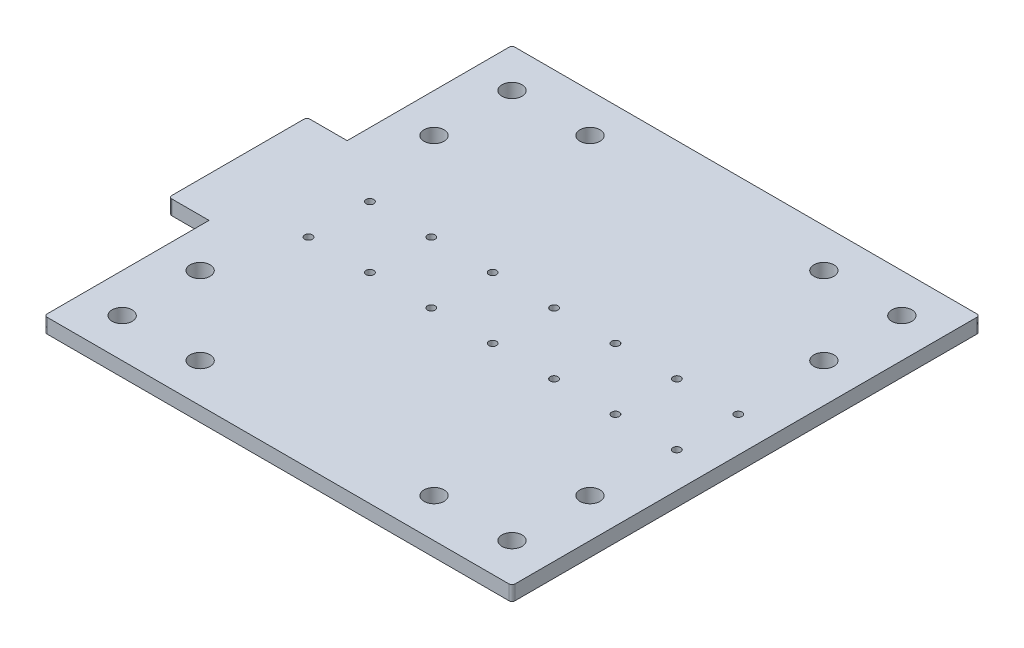
from build123d import *

# Parameters (mm, degrees)
SKETCH1_W             = 152.4
SKETCH1_H             = 152.4
SKETCH1_R             = 3.2639
SKETCH1_W_2           = 13.1
SKETCH1_H_2           = 45
BOSS_EXTRUDE1_DEPTH   = 4.7625
FILLET1_R             = 1
SKETCH11_R            = 1
CUT_EXTRUDE1_DEPTH    = 4.7625
M3X0_5_TAPPED_HOLE1_D = 2.5
LPATTERN1_COUNT       = 7
LPATTERN1_PITCH       = 20
LPATTERN1_COUNT_DIR2  = 2
LPATTERN1_PITCH_DIR2  = 20


with BuildPart() as part:
    # Sketch1 → Boss-Extrude1 (new body)
    # profile 1 of 2: a face of its own
    with BuildSketch(Plane(origin=(0, 0, 0), x_dir=(1, 0, 0), z_dir=(0, 1, 0))):
        with Locations((76.2, -76.2)):
            Rectangle(SKETCH1_W, SKETCH1_H)
        with Locations(Location((12.7, -12.7, 0), (0, 0, 90))):
            Circle(SKETCH1_R, mode=Mode.SUBTRACT)
        with Locations(Location((139.7, -12.7, 0), (0, 0, 90))):
            Circle(SKETCH1_R, mode=Mode.SUBTRACT)
        with Locations(Location((139.7, -139.7, 0), (0, 0, 90))):
            Circle(SKETCH1_R, mode=Mode.SUBTRACT)
        with Locations(Location((12.7, -139.7, 0), (0, 0, 90))):
            Circle(SKETCH1_R, mode=Mode.SUBTRACT)
        with Locations(Location((38.1, -12.7, 0), (0, 0, 90))):
            Circle(SKETCH1_R, mode=Mode.SUBTRACT)
        with Locations(Location((114.3, -12.7, 0), (0, 0, 90))):
            Circle(SKETCH1_R, mode=Mode.SUBTRACT)
        with Locations(Location((139.7, -38.1, 0), (0, 0, 90))):
            Circle(SKETCH1_R, mode=Mode.SUBTRACT)
        with Locations(Location((139.7, -114.3, 0), (0, 0, 90))):
            Circle(SKETCH1_R, mode=Mode.SUBTRACT)
        with Locations(Location((114.3, -139.7, 0), (0, 0, 90))):
            Circle(SKETCH1_R, mode=Mode.SUBTRACT)
        with Locations(Location((38.1, -139.7, 0), (0, 0, 90))):
            Circle(SKETCH1_R, mode=Mode.SUBTRACT)
        with Locations(Location((12.7, -114.3, 0), (0, 0, 90))):
            Circle(SKETCH1_R, mode=Mode.SUBTRACT)
        with Locations(Location((12.7, -38.1, 0), (0, 0, 90))):
            Circle(SKETCH1_R, mode=Mode.SUBTRACT)
    # profile 2 of 2: a face of its own
    with BuildSketch(Plane(origin=(0, 0, 0), x_dir=(1, 0, 0), z_dir=(0, 1, 0))):
        with Locations((-6.55, -76.2)):
            Rectangle(SKETCH1_W_2, SKETCH1_H_2)
    extrude(amount=BOSS_EXTRUDE1_DEPTH)

    # Fillet1
    fillet1_edges = [part.edges().sort_by_distance(p)[0] for p in [
        (152.4, 2.38125, 152.4),
        (0, 2.38125, 152.4),
        (-13.1, 2.38125, 98.7),
        (-13.1, 2.38125, 53.7),
        (0, 2.38125, 0),
        (152.4, 2.38125, 0),
    ]]
    fillet(fillet1_edges, radius=FILLET1_R)

    # Sketch11 → Cut-Extrude1 (cut)
    with BuildSketch(Plane(origin=(0, 4.7625, 0), x_dir=(1, 0, 0), z_dir=(0, 1, 0))):
        with Locations(Location((20.905, -87.2, 0), (0, 0, 270))):
            Circle(SKETCH11_R)
        with Locations(Location((20.905, -67.2, 0), (0, 0, 270))):
            Circle(SKETCH11_R)
        with Locations(Location((40.905, -87.2, 0), (0, 0, 270))):
            Circle(SKETCH11_R)
        with Locations(Location((40.905, -67.2, 0), (0, 0, 270))):
            Circle(SKETCH11_R)
        with Locations(Location((60.905, -87.2, 0), (0, 0, 270))):
            Circle(SKETCH11_R)
        with Locations(Location((60.905, -67.2, 0), (0, 0, 270))):
            Circle(SKETCH11_R)
        with Locations(Location((80.905, -87.2, 0), (0, 0, 270))):
            Circle(SKETCH11_R)
        with Locations(Location((80.905, -67.2, 0), (0, 0, 270))):
            Circle(SKETCH11_R)
        with Locations(Location((100.905, -87.2, 0), (0, 0, 270))):
            Circle(SKETCH11_R)
        with Locations(Location((100.905, -67.2, 0), (0, 0, 270))):
            Circle(SKETCH11_R)
        with Locations(Location((120.905, -87.2, 0), (0, 0, 270))):
            Circle(SKETCH11_R)
        with Locations(Location((120.905, -67.2, 0), (0, 0, 270))):
            Circle(SKETCH11_R)
        with Locations(Location((140.905, -87.2, 0), (0, 0, 270))):
            Circle(SKETCH11_R)
        with Locations(Location((140.905, -67.2, 0), (0, 0, 270))):
            Circle(SKETCH11_R)
    extrude(amount=-CUT_EXTRUDE1_DEPTH, mode=Mode.SUBTRACT)

    # M3x0.5 Tapped Hole1 (through all)
    with Locations(Plane(origin=(20.905, 4.7625, 67.2), x_dir=(0, 0, 1), z_dir=(0, 1, 0))):
        with Locations((0, 0)):
            m3x0_5_tapped_hole1 = Hole(M3X0_5_TAPPED_HOLE1_D / 2)

    # LPattern1: M3x0.5 Tapped Hole1 7 × 2
    with Locations(*[(i * LPATTERN1_PITCH, 0, j * LPATTERN1_PITCH_DIR2) for i in range(LPATTERN1_COUNT) for j in range(LPATTERN1_COUNT_DIR2) if (i, j) != (0, 0)]):
        add(m3x0_5_tapped_hole1, mode=Mode.SUBTRACT)


solid = part.part
